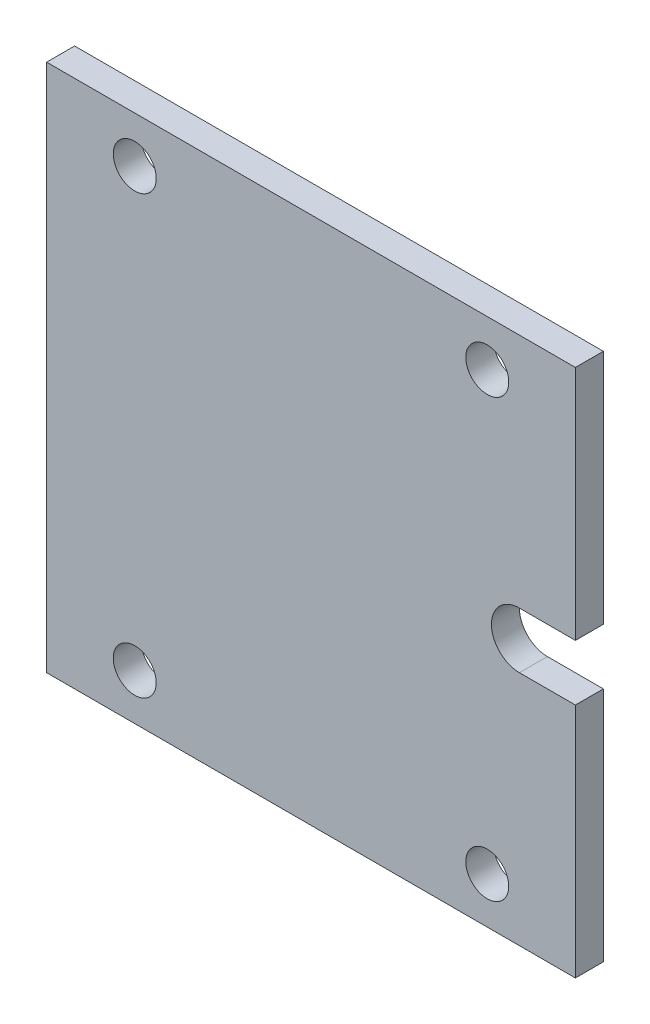
from build123d import *

# Parameters (mm, degrees)
SKETCH2_W           = 30
SKETCH2_H           = 30
SKETCH2_R           = 1.2192
BOSS_EXTRUDE1_DEPTH = 1.5875
CUT_EXTRUDE1_DEPTH  = 22.272521154


with BuildPart() as part:
    # Sketch2 → Boss-Extrude1 (new body)
    with BuildSketch(Plane.XY):
        Rectangle(SKETCH2_W, SKETCH2_H)
        with Locations((-10, 12.38905)):
            Circle(SKETCH2_R, mode=Mode.SUBTRACT)
        with Locations((10, 12.38905)):
            Circle(SKETCH2_R, mode=Mode.SUBTRACT)
        with Locations((10, -12.38905)):
            Circle(SKETCH2_R, mode=Mode.SUBTRACT)
        with Locations((-10, -12.38905)):
            Circle(SKETCH2_R, mode=Mode.SUBTRACT)
    extrude(amount=BOSS_EXTRUDE1_DEPTH)

    # Sketch3 → Cut-Extrude1 (cut, through all)
    with BuildSketch(Plane(origin=(0, 0, 0), x_dir=(-1, 0, 0), z_dir=(0, 0, -1))):
        with BuildLine():
            Line((-11.825, -1.5875), (-15, -1.5875))
            Line((-15, -1.5875), (-15, 1.5875))
            Line((-15, 1.5875), (-11.825, 1.5875))
            ThreePointArc((-11.825, 1.5875), (-10.2375, 0), (-11.825, -1.5875))
        make_face()
    extrude(amount=-CUT_EXTRUDE1_DEPTH, mode=Mode.SUBTRACT)


solid = part.part
